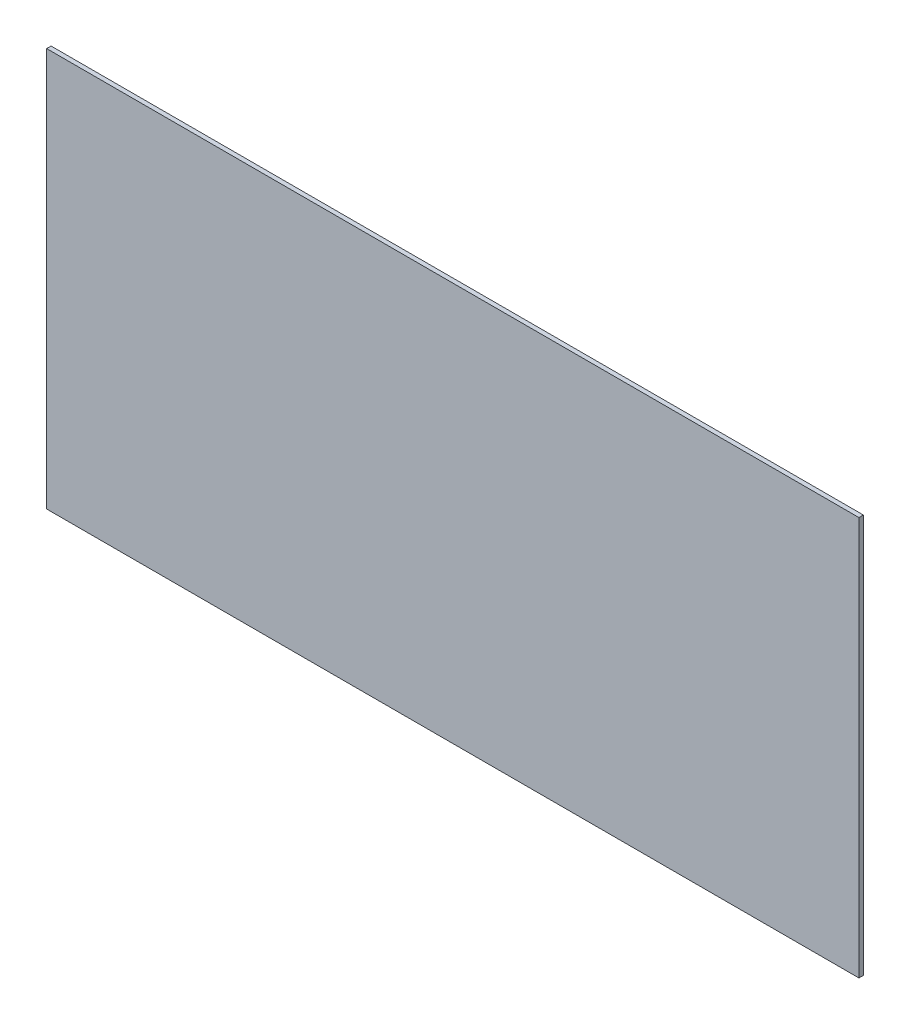
from build123d import *

# Parameters (mm, degrees)
SKETCH1_W           = 550
SKETCH1_H           = 270
BOSS_EXTRUDE1_DEPTH = 3


with BuildPart() as part:
    # Sketch1 → Boss-Extrude1 (new body)
    with BuildSketch(Plane.XY):
        Rectangle(SKETCH1_W, SKETCH1_H)
    extrude(amount=BOSS_EXTRUDE1_DEPTH)


solid = part.part
